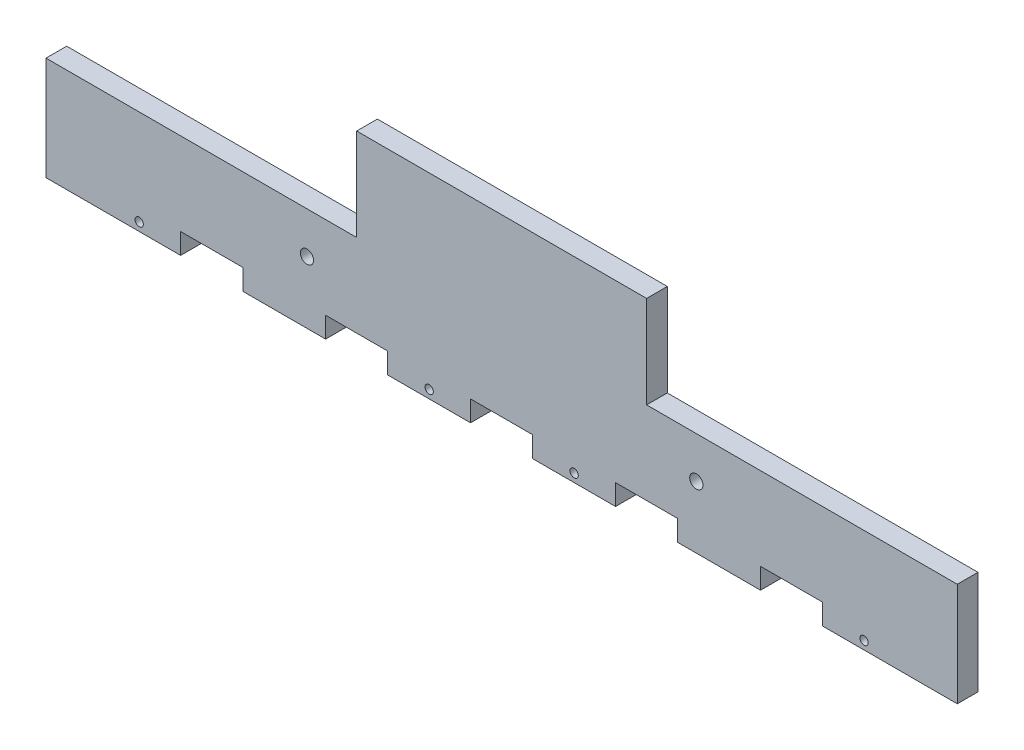
from build123d import *

# Parameters (mm, degrees)
SKETCH_1_W          = 220
SKETCH_1_H          = 25
EXTRUDE_1_DEPTH     = 5
SKETCH_2_W          = 70
SKETCH_2_H          = 22.26349322
EXTRUDE_2_DEPTH     = 5
SKETCH_3_W          = 15
SKETCH_3_H          = 5
CUT_EXTRUDE_1_DEPTH = 226.075182531
SKETCH_4_R          = 1.6
CUT_EXTRUDE_2_DEPTH = 226.075182531
SKETCH_7_R          = 1
CUT_EXTRUDE_4_DEPTH = 226.075182531


with BuildPart() as part:
    # 草图1 → 凸台-拉伸1 (new body)
    with BuildSketch(Plane.XY):
        with Locations((110, 12.5)):
            Rectangle(SKETCH_1_W, SKETCH_1_H)
    extrude(amount=EXTRUDE_1_DEPTH)

    # 草图2 → 凸台-拉伸2 (add)
    with BuildSketch(Plane.XY.offset(5)):
        with Locations((110, 36.13174661)):
            Rectangle(SKETCH_2_W, SKETCH_2_H)
    extrude(amount=-EXTRUDE_2_DEPTH)

    # 草图3 → 切除-拉伸1 (cut, through all)
    with BuildSketch(Plane.XY.offset(5)):
        with Locations((110, 2.5)):
            Rectangle(SKETCH_3_W, SKETCH_3_H)
        with Locations((145, 2.5)):
            Rectangle(SKETCH_3_W, SKETCH_3_H)
        with Locations((180, 2.5)):
            Rectangle(SKETCH_3_W, SKETCH_3_H)
        with Locations((75, 2.5)):
            Rectangle(SKETCH_3_W, SKETCH_3_H)
        with Locations((40, 2.5)):
            Rectangle(SKETCH_3_W, SKETCH_3_H)
    extrude(amount=-CUT_EXTRUDE_1_DEPTH, mode=Mode.SUBTRACT)

    # 草图4 → 切除-拉伸2 (cut, through all)
    with BuildSketch(Plane.XY.offset(5)):
        with Locations((63, 15)):
            Circle(SKETCH_4_R)
        with Locations((157, 15)):
            Circle(SKETCH_4_R)
    extrude(amount=-CUT_EXTRUDE_2_DEPTH, mode=Mode.SUBTRACT)

    # 草图7 → 切除-拉伸4 (cut, through all)
    with BuildSketch(Plane.XY.offset(5)):
        with Locations((22.5, 2)):
            Circle(SKETCH_7_R)
        with Locations((92.5, 2)):
            Circle(SKETCH_7_R)
        with Locations((127.5, 2)):
            Circle(SKETCH_7_R)
        with Locations((197.5, 2)):
            Circle(SKETCH_7_R)
    extrude(amount=-CUT_EXTRUDE_4_DEPTH, mode=Mode.SUBTRACT)


solid = part.part
